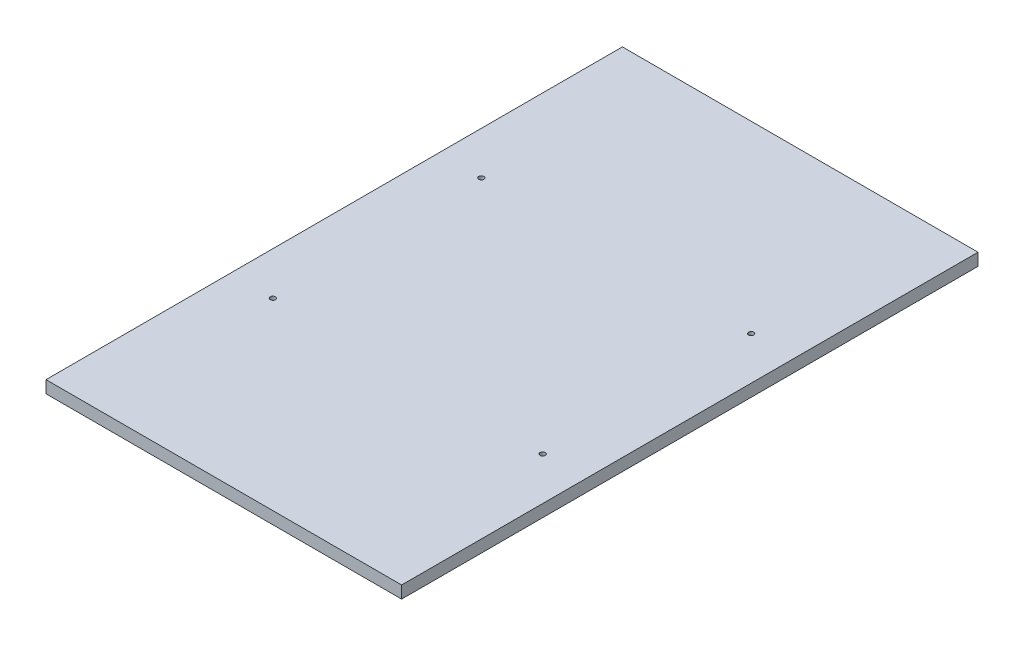
from build123d import *

# Parameters (mm, degrees)
SKETCH1_W             = 290
SKETCH1_H             = 470
BOSS_EXTRUDE1_DEPTH   = 10
M5X0_8_TAPPED_HOLE1_D = 4.2


with BuildPart() as part:
    # Sketch1 → Boss-Extrude1 (new body)
    with BuildSketch(Plane(origin=(0, 0, 0), x_dir=(1, 0, 0), z_dir=(0, 1, 0))):
        with Locations((0, -35)):
            Rectangle(SKETCH1_W, SKETCH1_H)
    extrude(amount=BOSS_EXTRUDE1_DEPTH)

    # M5x0.8 Tapped Hole1 (through all)
    with Locations(Plane(origin=(0, 10, 0), x_dir=(1, 0, 0), z_dir=(0, 1, 0))):
        with Locations((-110, 50), (110, 50), (110, -120), (-110, -120)):
            Hole(M5X0_8_TAPPED_HOLE1_D / 2)


solid = part.part
